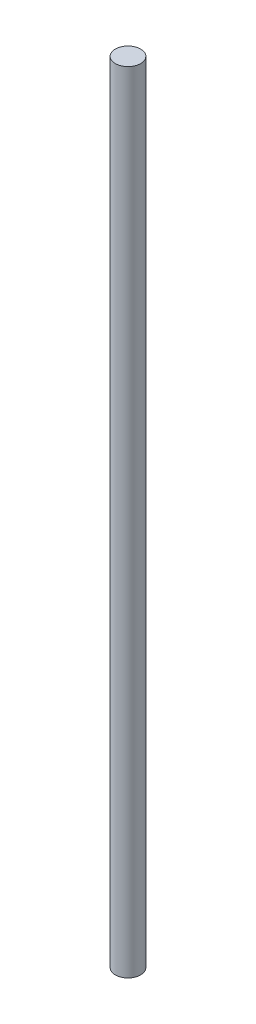
from build123d import *

# Parameters (mm, degrees)
CROQUIS1_R              = 4
SALIENTE_EXTRUIR1_DEPTH = 250


with BuildPart() as part:
    # Croquis1 → Saliente-Extruir1 (new body)
    with BuildSketch(Plane(origin=(0, 0, 0), x_dir=(1, 0, 0), z_dir=(0, 1, 0))):
        with Locations(Location((0, 0, 0), (0, 0, 270))):
            Circle(CROQUIS1_R)
    extrude(amount=SALIENTE_EXTRUIR1_DEPTH)


solid = part.part
